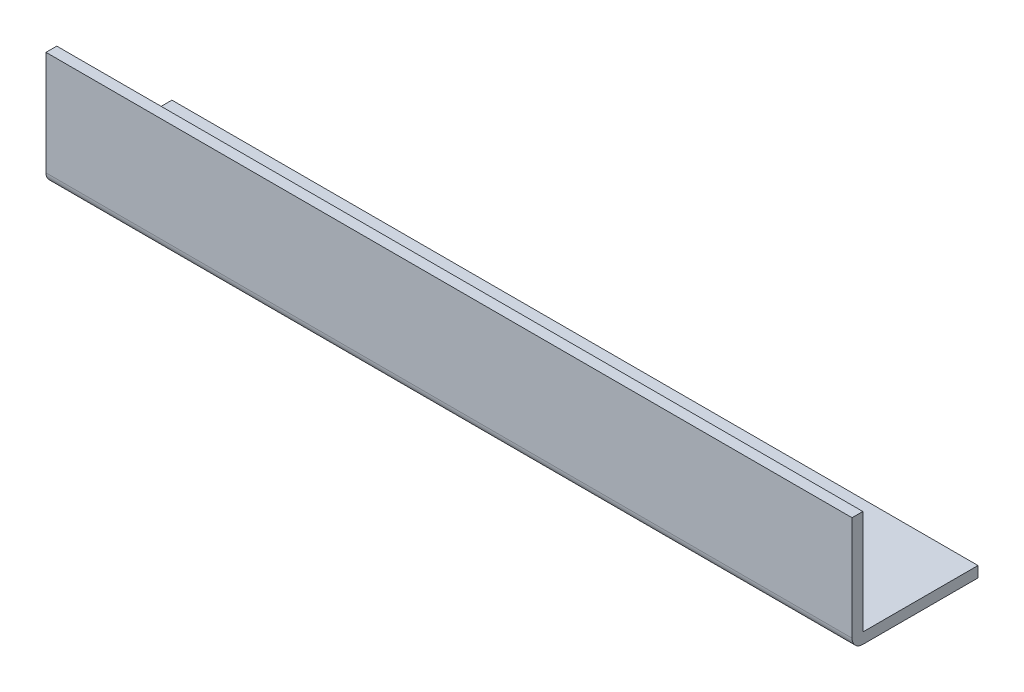
from build123d import *

# Parameters (mm, degrees)
SKETCH1_W           = 177.8
SKETCH1_H           = 25.4
BOSS_EXTRUDE1_DEPTH = 2.38125
SKETCH2_W           = 177.8
SKETCH2_H           = 25.4
BOSS_EXTRUDE2_DEPTH = 2.38125
FILLET1_R           = 2.38125


with BuildPart() as part:
    # Sketch1 → Boss-Extrude1 (new body)
    with BuildSketch(Plane(origin=(0, 0, 0), x_dir=(1, 0, 0), z_dir=(0, 1, 0))):
        with Locations((88.9, 12.7)):
            Rectangle(SKETCH1_W, SKETCH1_H)
    extrude(amount=BOSS_EXTRUDE1_DEPTH)

    # Sketch2 → Boss-Extrude2 (add)
    with BuildSketch(Plane.XY):
        with Locations((88.9, 12.7)):
            Rectangle(SKETCH2_W, SKETCH2_H)
    extrude(amount=BOSS_EXTRUDE2_DEPTH)

    # Fillet1
    fillet1_edges = [part.edges().sort_by_distance(p)[0] for p in [
        (88.9, 0, 2.38125),
    ]]
    fillet(fillet1_edges, radius=FILLET1_R)


solid = part.part
